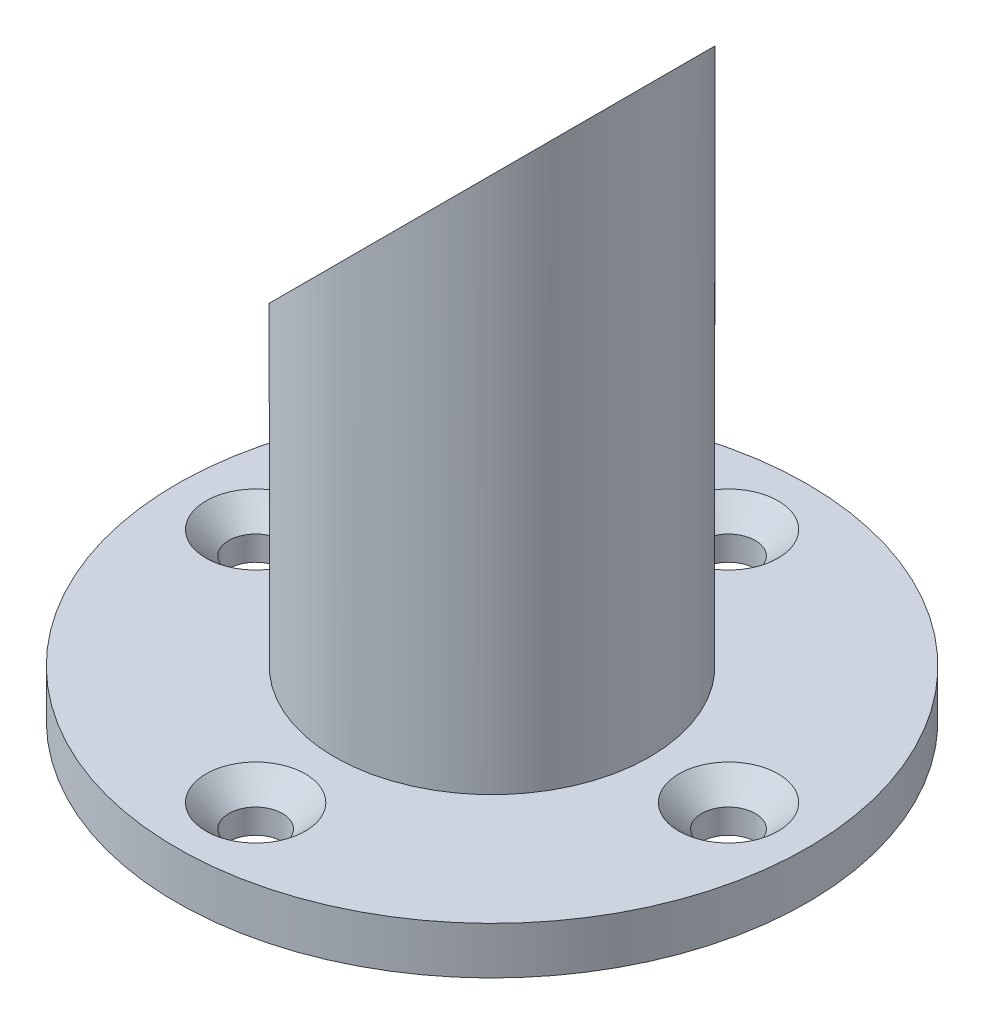
from build123d import *

# Parameters (mm, degrees)
SKETCH1_R               = 10
BOSS_EXTRUDE1_DEPTH     = 40
SKETCH2_R               = 20
BOSS_EXTRUDE2_DEPTH     = 3
CIRPATTERN1_COUNT       = 4
CUT_EXTRUDE1_DEPTH      = 49.989794856
CUT_EXTRUDE1_DEPTH_BACK = 49.989794856
M6_TAPPED_HOLE1_D       = 5
M6_TAPPED_HOLE1_DEPTH   = 10
M6_TAPPED_HOLE1_TIP     = 1.502151548


with BuildPart() as part:
    # Sketch1 → Boss-Extrude1 (new body)
    with BuildSketch(Plane(origin=(0, 0, 0), x_dir=(1, 0, 0), z_dir=(0, 1, 0))):
        Circle(SKETCH1_R)
    extrude(amount=BOSS_EXTRUDE1_DEPTH)

    # Sketch2 → Boss-Extrude2 (add)
    with BuildSketch(Plane.XZ):
        Circle(SKETCH2_R)
    extrude(amount=-BOSS_EXTRUDE2_DEPTH)

    # Sketch3 → CSK for M3 Countersunk Flat Head Screw1 (revolve, cut)
    with BuildSketch(Plane(origin=(0, 3, -15), x_dir=(0, 0, 1), z_dir=(1, 0, 0))):
        Polygon((0, 0), (0, 3), (1.7, 3), (1.7, 1.45), (3.15, 0), align=None)
    csk_for_m3_countersunk_flat_head_screw1 = revolve(axis=Axis((0, 9.35, -15), (0, -1, 0)), mode=Mode.SUBTRACT)

    # CirPattern1: CSK for M3 Countersunk Flat Head Screw1 ×4 about axis
    cirpattern1_axis = Axis((0, 3, 0), (0, -1, 0))
    for i in range(1, CIRPATTERN1_COUNT):
        add(csk_for_m3_countersunk_flat_head_screw1.rotate(cirpattern1_axis, i * 360 / CIRPATTERN1_COUNT), mode=Mode.SUBTRACT)

    # Sketch5 → Cut-Extrude1 (cut, two sides: drawn at the far end of the back side and taken through both)
    with BuildSketch(Plane.XY.offset(-CUT_EXTRUDE1_DEPTH_BACK)):
        Polygon((-10, 40), (10, 40), (-10, 20), align=None)
    extrude(amount=CUT_EXTRUDE1_DEPTH + CUT_EXTRUDE1_DEPTH_BACK, mode=Mode.SUBTRACT)

    # M6 Tapped Hole1
    with Locations(Plane(origin=(-15, 15, 0), x_dir=(0.7071067811865475, 0.7071067811865477, 0), z_dir=(-0.7071067811865477, 0.7071067811865475, 0))):
        with Locations((21.213203436, 0)):
            Hole(M6_TAPPED_HOLE1_D / 2, depth=M6_TAPPED_HOLE1_DEPTH)
            with Locations((0, 0, -(M6_TAPPED_HOLE1_DEPTH + M6_TAPPED_HOLE1_TIP / 2))):  # 118° drill point
                Cone(0, M6_TAPPED_HOLE1_D / 2, M6_TAPPED_HOLE1_TIP, mode=Mode.SUBTRACT)


solid = part.part
